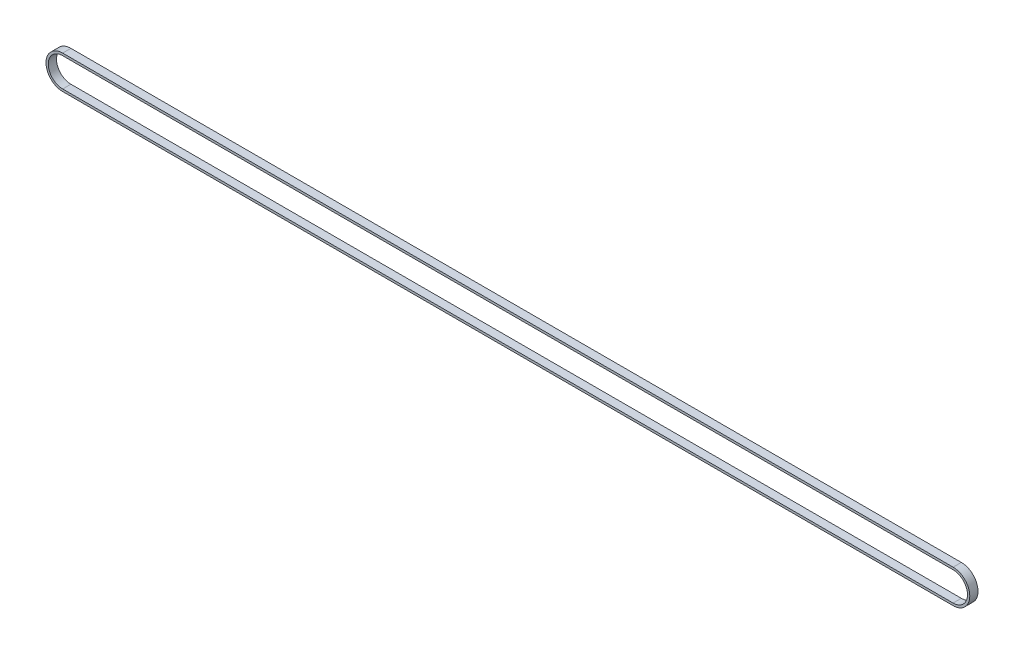
from build123d import *

# Parameters (mm, degrees)
EXTRUDE_THIN1_DEPTH = 2.5


with BuildPart() as part:
    # Sketch1 → Extrude-Thin1 (new, symmetric)
    with BuildSketch(Plane.XY):
        with BuildLine():
            Line((541, -10.13), (0, -10.13))
            ThreePointArc((0, -10.13), (-10.13, 0), (0, 10.13))
            Line((0, 10.13), (541, 10.13))
            ThreePointArc((541, 10.13), (551.13, 0), (541, -10.13))
        make_face()
        with BuildLine():
            Line((541, -8.75), (0, -8.75))
            ThreePointArc((0, -8.75), (-8.75, 0), (0, 8.75))
            Line((0, 8.75), (541, 8.75))
            ThreePointArc((541, 8.75), (549.75, 0), (541, -8.75))
        make_face(mode=Mode.SUBTRACT)
    extrude(amount=EXTRUDE_THIN1_DEPTH, both=True)


solid = part.part
